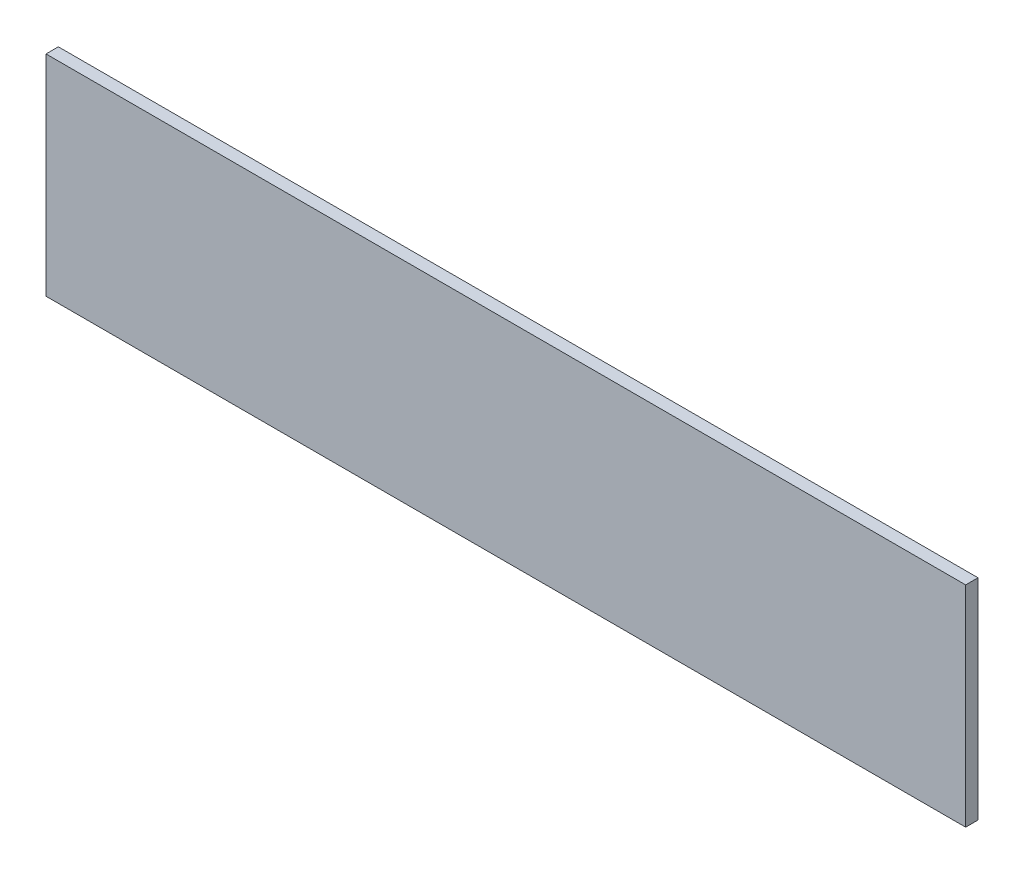
from build123d import *

# Parameters (mm, degrees)
SKETCH1_W           = 149
SKETCH1_H           = 34
BOSS_EXTRUDE1_DEPTH = 2


with BuildPart() as part:
    # Sketch1 → Boss-Extrude1 (new body)
    with BuildSketch(Plane.XY):
        Rectangle(SKETCH1_W, SKETCH1_H)
    extrude(amount=BOSS_EXTRUDE1_DEPTH)


solid = part.part
